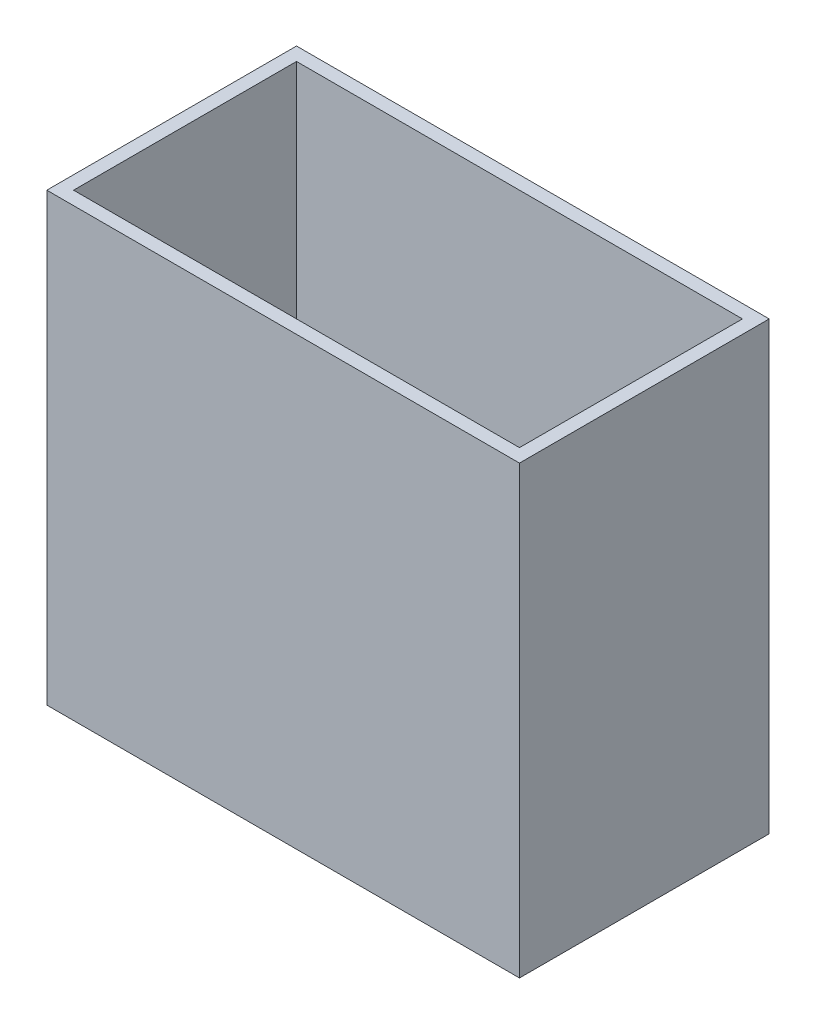
from build123d import *

# Parameters (mm, degrees)
SKETCH_1_W      = 106
SKETCH_1_H      = 56
SKETCH_1_W_2    = 100
SKETCH_1_H_2    = 50
EXTRUDE_1_DEPTH = 100


with BuildPart() as part:
    # 草圖1 → 填料-伸長1 (new body)
    with BuildSketch(Plane(origin=(0, 0, 0), x_dir=(1, 0, 0), z_dir=(0, 1, 0))):
        with Locations((53, 28)):
            Rectangle(SKETCH_1_W, SKETCH_1_H)
        with Locations((53, 28)):
            Rectangle(SKETCH_1_W_2, SKETCH_1_H_2, mode=Mode.SUBTRACT)
    extrude(amount=EXTRUDE_1_DEPTH)


solid = part.part
